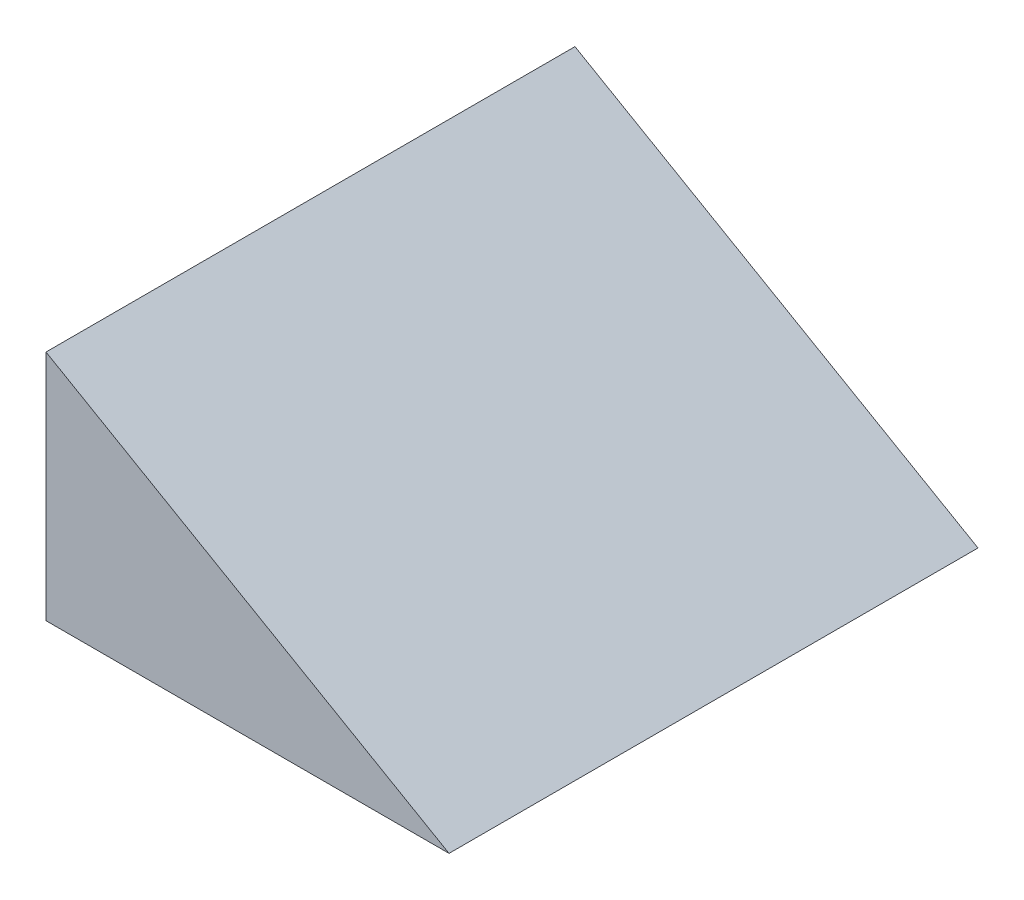
from build123d import *

# Parameters (mm, degrees)
BOSS_EXTRUDE1_DEPTH = 21


with BuildPart() as part:
    # Sketch1 → Boss-Extrude1 (new body)
    with BuildSketch(Plane.XY):
        Polygon((16, 0), (0, 9.237604307), (0, 0), align=None)
    extrude(amount=BOSS_EXTRUDE1_DEPTH)


solid = part.part
